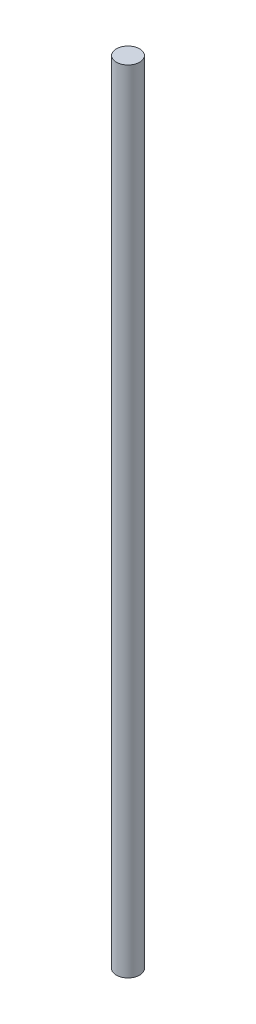
from build123d import *

# Parameters (mm, degrees)
SKETCH1_R           = 0.5
BOSS_EXTRUDE1_DEPTH = 34


with BuildPart() as part:
    # Sketch1 → Boss-Extrude1 (new body)
    with BuildSketch(Plane(origin=(0, 0, 0), x_dir=(1, 0, 0), z_dir=(0, 1, 0))):
        with Locations(Location((0, 0, 0), (0, 0, 270))):
            Circle(SKETCH1_R)
    extrude(amount=BOSS_EXTRUDE1_DEPTH)


solid = part.part
